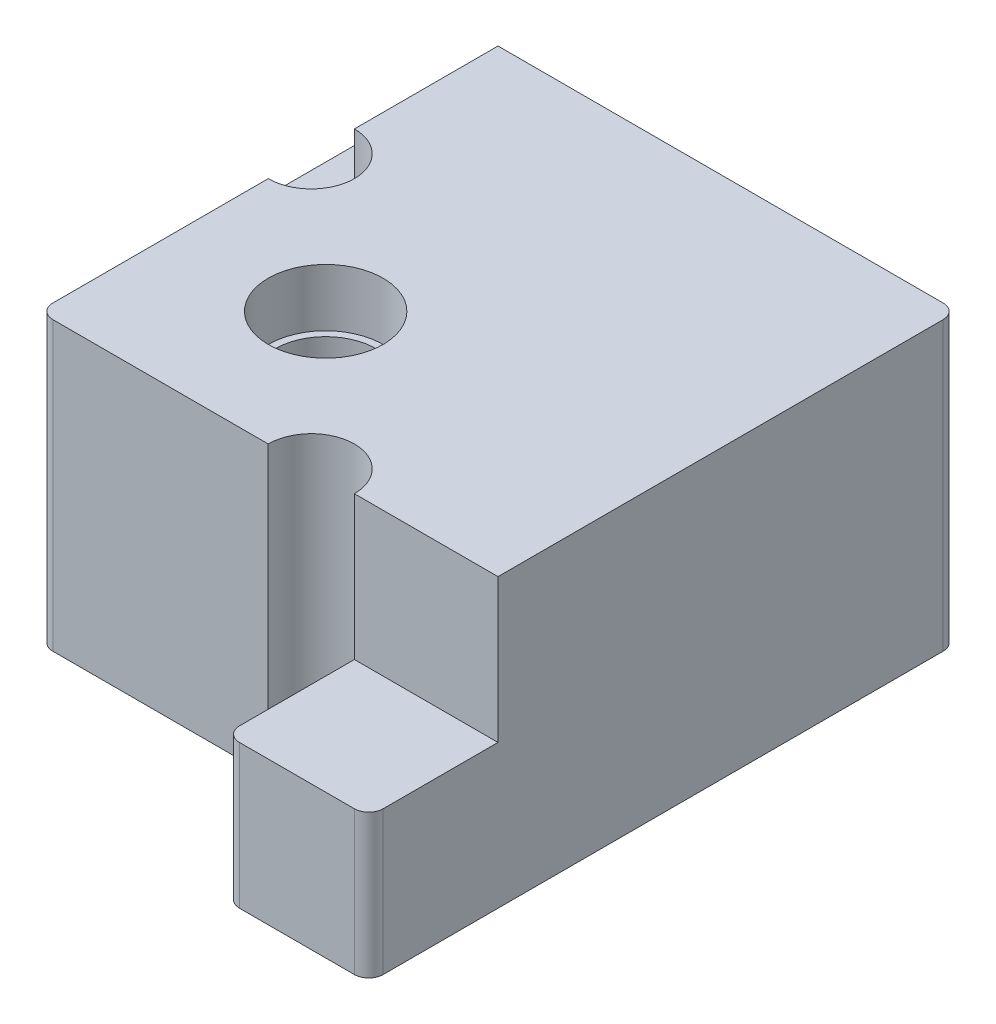
from build123d import *

# Parameters (mm, degrees)
BOSS_EXTRUDE1_DEPTH = 10
SKETCH4_R           = 1.75
CUT_EXTRUDE3_DEPTH  = 10
SKETCH6_R           = 2
CUT_EXTRUDE5_DEPTH  = 2
CUT_EXTRUDE6_DEPTH  = 31.66757245
SKETCH8_W           = 5
SKETCH8_H           = 4.5
SKETCH8_W_2         = 4.5
SKETCH8_H_2         = 5
CUT_EXTRUDE7_DEPTH  = 5
FILLET1_R           = 0.5


with BuildPart() as part:
    # Sketch1 → Boss-Extrude1 (new body)
    with BuildSketch(Plane(origin=(0, 0, 0), x_dir=(1, 0, 0), z_dir=(0, 1, 0))):
        Polygon((0, 0), (20.5, 0), (20.5, -20.5), (15.5, -20.5), (15.5, -16), (4.5, -16), (4.5, -5), (0, -5), align=None)
    extrude(amount=BOSS_EXTRUDE1_DEPTH)

    # Sketch4 → Cut-Extrude3 (cut)
    with BuildSketch(Plane(origin=(0, 10, 0), x_dir=(1, 0, 0), z_dir=(0, 1, 0))):
        with Locations(Location((9.5, -11, 0), (0, 0, 270))):
            Circle(SKETCH4_R)
    extrude(amount=-CUT_EXTRUDE3_DEPTH, mode=Mode.SUBTRACT)

    # Sketch6 → Cut-Extrude5 (cut)
    with BuildSketch(Plane(origin=(0, 10, 0), x_dir=(1, 0, 0), z_dir=(0, 1, 0))):
        with Locations(Location((9.5, -11, 0), (0, 0, 270))):
            Circle(SKETCH6_R)
    extrude(amount=-CUT_EXTRUDE5_DEPTH, mode=Mode.SUBTRACT)

    # Sketch7 → Cut-Extrude6 (cut, through all)
    with BuildSketch(Plane.XZ):
        with BuildLine():
            Line((0, 8), (4.5, 8))
            ThreePointArc((4.5, 8), (6, 6.5), (4.5, 5))
            Line((4.5, 5), (0, 5))
            ThreePointArc((0, 5), (-1.5, 6.5), (0, 8))
        make_face()
        with BuildLine():
            Line((12.5, 16), (12.5, 20.5))
            ThreePointArc((12.5, 20.5), (14, 22), (15.5, 20.5))
            Line((15.5, 20.5), (15.5, 16))
            ThreePointArc((15.5, 16), (14, 14.5), (12.5, 16))
        make_face()
    extrude(amount=-CUT_EXTRUDE6_DEPTH, mode=Mode.SUBTRACT)

    # Sketch8 → Cut-Extrude7 (cut)
    with BuildSketch(Plane(origin=(0, 10, 0), x_dir=(1, 0, 0), z_dir=(0, 1, 0))):
        with Locations((18, -18.25)):
            Rectangle(SKETCH8_W, SKETCH8_H)
        with Locations((2.25, -2.5)):
            Rectangle(SKETCH8_W_2, SKETCH8_H_2)
    extrude(amount=-CUT_EXTRUDE7_DEPTH, mode=Mode.SUBTRACT)

    # Fillet1
    fillet1_edges = [part.edges().sort_by_distance(p)[0] for p in [
        (4.5, 5, 16),
        (20.5, 5, 0),
        (20.5, 2.5, 20.5),
        (15.5, 2.5, 20.5),
        (0, 2.5, 5),
        (0, 2.5, 0),
    ]]
    fillet(fillet1_edges, radius=FILLET1_R)


solid = part.part
